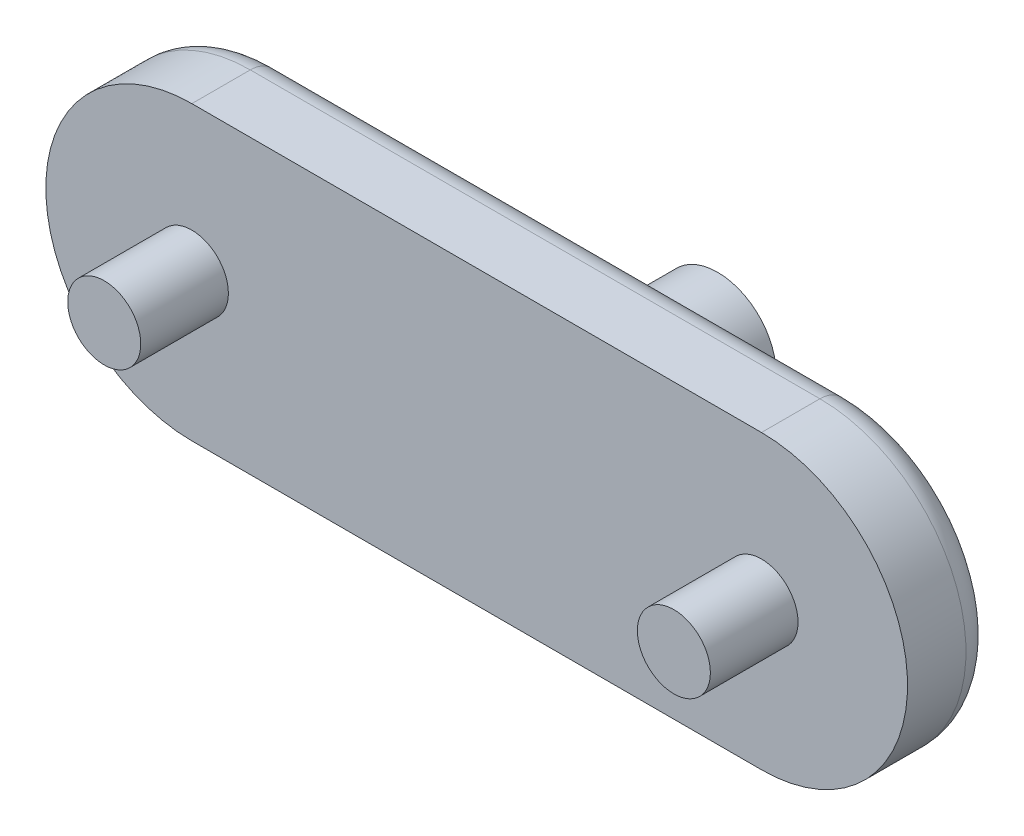
from build123d import *

# Parameters (mm, degrees)
BOSS_EXTRU_1_DEPTH = 3
ESQUISSE2_R        = 1.25
BOSS_EXTRU_2_DEPTH = 3
ESQUISSE3_R        = 2
BOSS_EXTRU_3_DEPTH = 4
CONG_1_R           = 1


with BuildPart() as part:
    # Esquisse1 → Boss.-Extru.1 (new body)
    with BuildSketch(Plane.XY):
        with BuildLine():
            Line((0, -5), (-19.5, -5))
            ThreePointArc((-19.5, -5), (-24.5, 0), (-19.5, 5))
            Line((-19.5, 5), (0, 5))
            ThreePointArc((0, 5), (5, 0), (0, -5))
        make_face()
    extrude(amount=BOSS_EXTRU_1_DEPTH)

    # Esquisse2 → Boss.-Extru.2 (add)
    with BuildSketch(Plane.XY.offset(3)):
        with Locations((-19.5, 0)):
            Circle(ESQUISSE2_R)
        Circle(ESQUISSE2_R)
    extrude(amount=BOSS_EXTRU_2_DEPTH)

    # Esquisse3 → Boss.-Extru.3 (add)
    with BuildSketch(Plane(origin=(0, 0, 0), x_dir=(-1, 0, 0), z_dir=(0, 0, -1))):
        with Locations(Location((8.5, 0, 0), (0, 0, 180))):
            Circle(ESQUISSE3_R)
    extrude(amount=BOSS_EXTRU_3_DEPTH)

    # Congé1
    cong_1_edges = [part.edges().sort_by_distance(p)[0] for p in [
        (-9.75, -5, 0),
        (-24.5, 0, 0),
        (-9.75, 5, 0),
        (5, 0, 0),
    ]]
    fillet(cong_1_edges, radius=CONG_1_R)


solid = part.part
